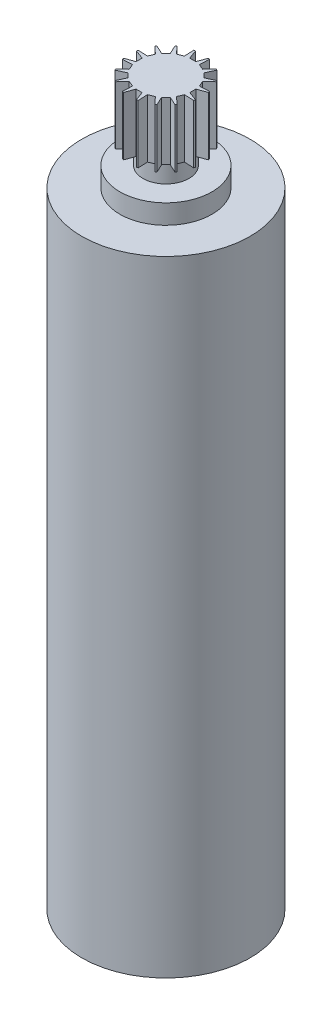
from build123d import *

# Parameters (mm, degrees)
SKETCH1_R           = 10.9855
BOSS_EXTRUDE1_DEPTH = 81.534
SKETCH2_R           = 6.0071
BOSS_EXTRUDE2_DEPTH = 2.54
SKETCH3_R           = 2.9972
BOSS_EXTRUDE3_DEPTH = 2.54
SKETCH4_R           = 4.7625
BOSS_EXTRUDE4_DEPTH = 7.62
CUT_EXTRUDE1_DEPTH  = 7.62


with BuildPart() as part:
    # Sketch1 → Boss-Extrude1 (new body)
    with BuildSketch(Plane(origin=(0, 0, 0), x_dir=(1, 0, 0), z_dir=(0, 1, 0))):
        with Locations(Location((0, 0, 0), (0, 0, 270))):
            Circle(SKETCH1_R)
    extrude(amount=BOSS_EXTRUDE1_DEPTH)

    # Sketch2 → Boss-Extrude2 (add)
    with BuildSketch(Plane(origin=(0, 81.534, 0), x_dir=(1, 0, 0), z_dir=(0, 1, 0))):
        with Locations(Location((0, 0, 0), (0, 0, 270))):
            Circle(SKETCH2_R)
    extrude(amount=BOSS_EXTRUDE2_DEPTH)

    # Sketch3 → Boss-Extrude3 (add)
    with BuildSketch(Plane(origin=(0, 84.074, 0), x_dir=(1, 0, 0), z_dir=(0, 1, 0))):
        with Locations(Location((0, 0, 0), (0, 0, 270))):
            Circle(SKETCH3_R)
    extrude(amount=BOSS_EXTRUDE3_DEPTH)

    # Sketch4 → Boss-Extrude4 (add)
    with BuildSketch(Plane(origin=(0, 86.614, 0), x_dir=(1, 0, 0), z_dir=(0, 1, 0))):
        with Locations(Location((0, 0, 0), (0, 0, 90))):
            Circle(SKETCH4_R)
    extrude(amount=BOSS_EXTRUDE4_DEPTH)

    # Sketch7 → Cut-Extrude1 (cut)
    with BuildSketch(Plane(origin=(0, 94.234, 0), x_dir=(1, 0, 0), z_dir=(0, 1, 0))):
        Polygon((-0.85725, 4.7625), (0.85725, 4.7625), (0.398425795, 3.501890859), (-0.398425795, 3.501890859), align=None)
        Polygon((1.708213051, 3.082854338), (0.972018176, 3.38779624), (1.030534117, 4.728031646), (2.614525576, 4.071920901), align=None)
        Polygon((2.757940355, 2.194481191), (2.194481191, 2.757940355), (2.761428757, 3.973763334), (3.973763334, 2.761428757), align=None)
        Polygon((3.38779624, 0.972018176), (3.082854338, 1.708213051), (4.071920901, 2.614525576), (4.728031646, 1.030534117), align=None)
        Polygon((3.501890859, -0.398425795), (3.501890859, 0.398425795), (4.7625, 0.85725), (4.7625, -0.85725), align=None)
        Polygon((3.082854338, -1.708213051), (3.38779624, -0.972018176), (4.728031646, -1.030534117), (4.071920901, -2.614525576), align=None)
        Polygon((2.194481191, -2.757940355), (2.757940355, -2.194481191), (3.973763334, -2.761428757), (2.761428757, -3.973763334), align=None)
        Polygon((0.972018176, -3.38779624), (1.708213051, -3.082854338), (2.614525576, -4.071920901), (1.030534117, -4.728031646), align=None)
        Polygon((-0.398425795, -3.501890859), (0.398425795, -3.501890859), (0.85725, -4.7625), (-0.85725, -4.7625), align=None)
        Polygon((-1.708213051, -3.082854338), (-0.972018176, -3.38779624), (-1.030534117, -4.728031646), (-2.614525576, -4.071920901), align=None)
        Polygon((-2.757940355, -2.194481191), (-2.194481191, -2.757940355), (-2.761428757, -3.973763334), (-3.973763334, -2.761428757), align=None)
        Polygon((-3.38779624, -0.972018176), (-3.082854338, -1.708213051), (-4.071920901, -2.614525576), (-4.728031646, -1.030534117), align=None)
        Polygon((-3.501890859, 0.398425795), (-3.501890859, -0.398425795), (-4.7625, -0.85725), (-4.7625, 0.85725), align=None)
        Polygon((-3.082854338, 1.708213051), (-3.38779624, 0.972018176), (-4.728031646, 1.030534117), (-4.071920901, 2.614525576), align=None)
        Polygon((-2.194481191, 2.757940355), (-2.757940355, 2.194481191), (-3.973763334, 2.761428757), (-2.761428757, 3.973763334), align=None)
        Polygon((-0.972018176, 3.38779624), (-1.708213051, 3.082854338), (-2.614525576, 4.071920901), (-1.030534117, 4.728031646), align=None)
    extrude(amount=-CUT_EXTRUDE1_DEPTH, mode=Mode.SUBTRACT)


solid = part.part
